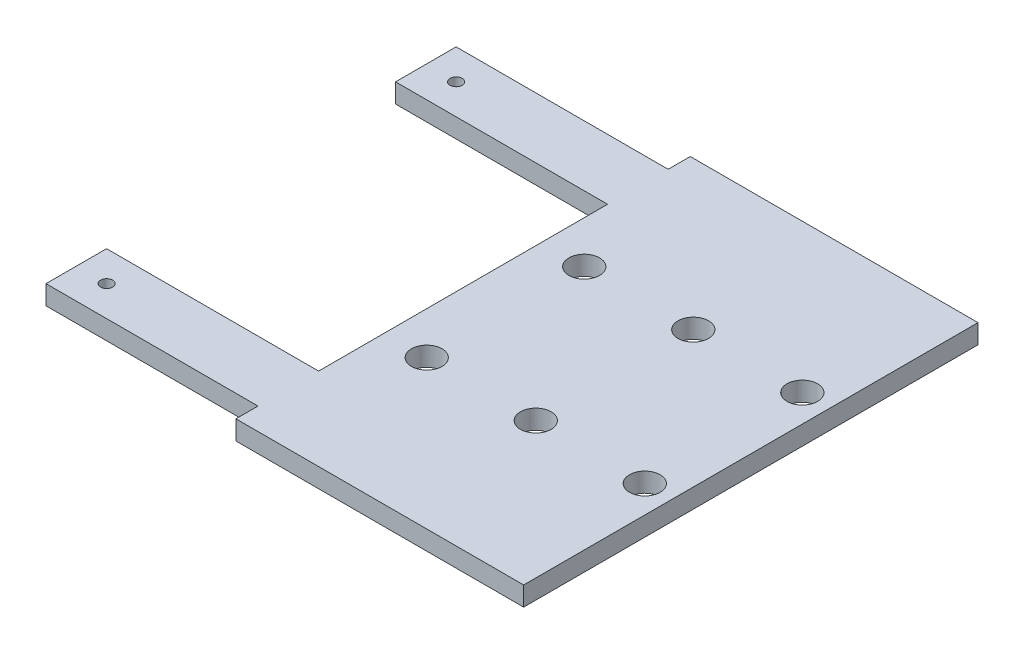
from build123d import *

# Parameters (mm, degrees)
SKETCH1_R           = 5.05
SKETCH1_R_2         = 2
BOSS_EXTRUDE1_DEPTH = 6.35


with BuildPart() as part:
    # Sketch1 → Boss-Extrude1 (new body)
    with BuildSketch(Plane(origin=(0, 0, 0), x_dir=(1, 0, 0), z_dir=(0, 1, 0))):
        Polygon((-120, -47.7), (-50, -47.7), (-50, 47.7), (-120, 47.7), (-120, 67.7), (-50, 67.7), (-50, 75), (45, 75), (45, -75), (-50, -75), (-50, -67.7), (-120, -67.7), align=None)
        with Locations(Location((-36, 26, 0), (0, 0, 270))):
            Circle(SKETCH1_R, mode=Mode.SUBTRACT)
        with Locations(Location((36, 26, 0), (0, 0, 270))):
            Circle(SKETCH1_R, mode=Mode.SUBTRACT)
        with Locations(Location((36, -26, 0), (0, 0, 270))):
            Circle(SKETCH1_R, mode=Mode.SUBTRACT)
        with Locations(Location((-36, -26, 0), (0, 0, 270))):
            Circle(SKETCH1_R, mode=Mode.SUBTRACT)
        with Locations(Location((0, 26, 0), (0, 0, 270))):
            Circle(SKETCH1_R, mode=Mode.SUBTRACT)
        with Locations(Location((0, -26, 0), (0, 0, 270))):
            Circle(SKETCH1_R, mode=Mode.SUBTRACT)
        with Locations(Location((-110, 57.7, 0), (0, 0, 270))):
            Circle(SKETCH1_R_2, mode=Mode.SUBTRACT)
        with Locations(Location((-110, -57.7, 0), (0, 0, 270))):
            Circle(SKETCH1_R_2, mode=Mode.SUBTRACT)
    extrude(amount=BOSS_EXTRUDE1_DEPTH)


solid = part.part
